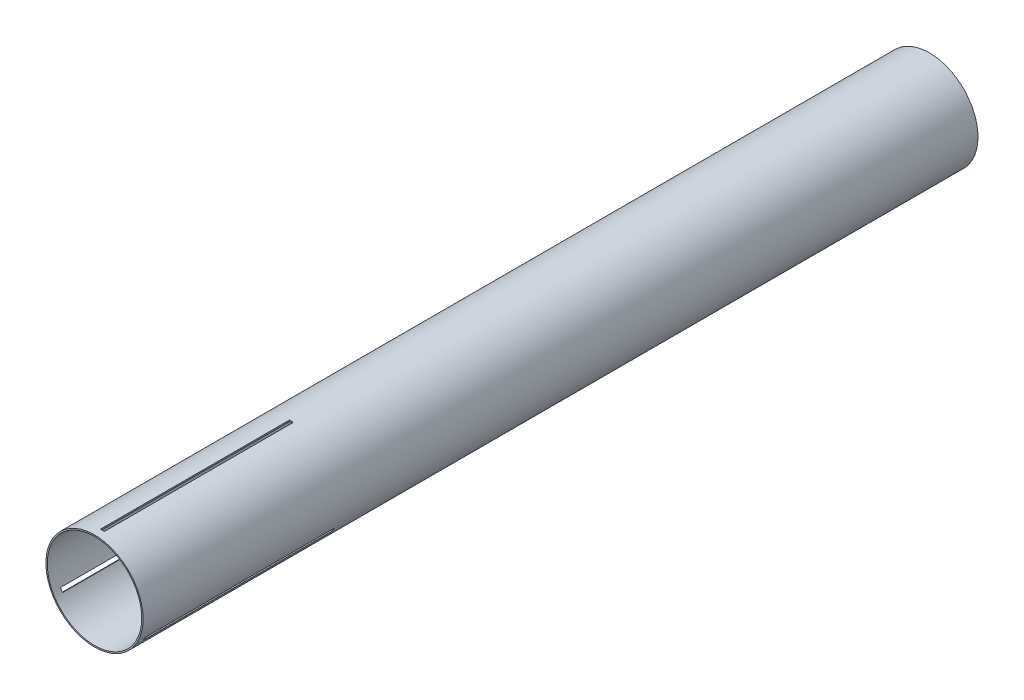
from build123d import *

# Parameters (mm, degrees)
ESQUISSE2_R                  = 78.359
ESQUISSE2_R_2                = 76.2
BOSS_EXTRU_1_DEPTH           = 1346.2
ESQUISSE3_W                  = 6.35
ESQUISSE3_H                  = 304.8
ENL_V_MAT_EXTRU_1_DEPTH      = 152.4
R_P_TITION_CIRCULAIRE1_COUNT = 3


with BuildPart() as part:
    # Esquisse2 → Boss.-Extru.1 (new body)
    with BuildSketch(Plane.XY):
        Circle(ESQUISSE2_R)
        Circle(ESQUISSE2_R_2, mode=Mode.SUBTRACT)
    extrude(amount=BOSS_EXTRU_1_DEPTH)

    # Esquisse3 → Enlèv. mat.-Extru.1 (cut)
    with BuildSketch(Plane(origin=(0, 0, 0), x_dir=(1, 0, 0), z_dir=(0, 1, 0))):
        with Locations((0, -1181.1)):
            Rectangle(ESQUISSE3_W, ESQUISSE3_H)
    enl_v_mat_extru_1 = extrude(amount=ENL_V_MAT_EXTRU_1_DEPTH, mode=Mode.SUBTRACT)

    # Répétition circulaire1: Enlèv. mat.-Extru.1 ×3 about axis
    r_p_tition_circulaire1_axis = Axis((0, 0, 0), (0, 0, 1))
    for i in range(1, R_P_TITION_CIRCULAIRE1_COUNT):
        add(enl_v_mat_extru_1.rotate(r_p_tition_circulaire1_axis, i * 360 / R_P_TITION_CIRCULAIRE1_COUNT), mode=Mode.SUBTRACT)


solid = part.part
